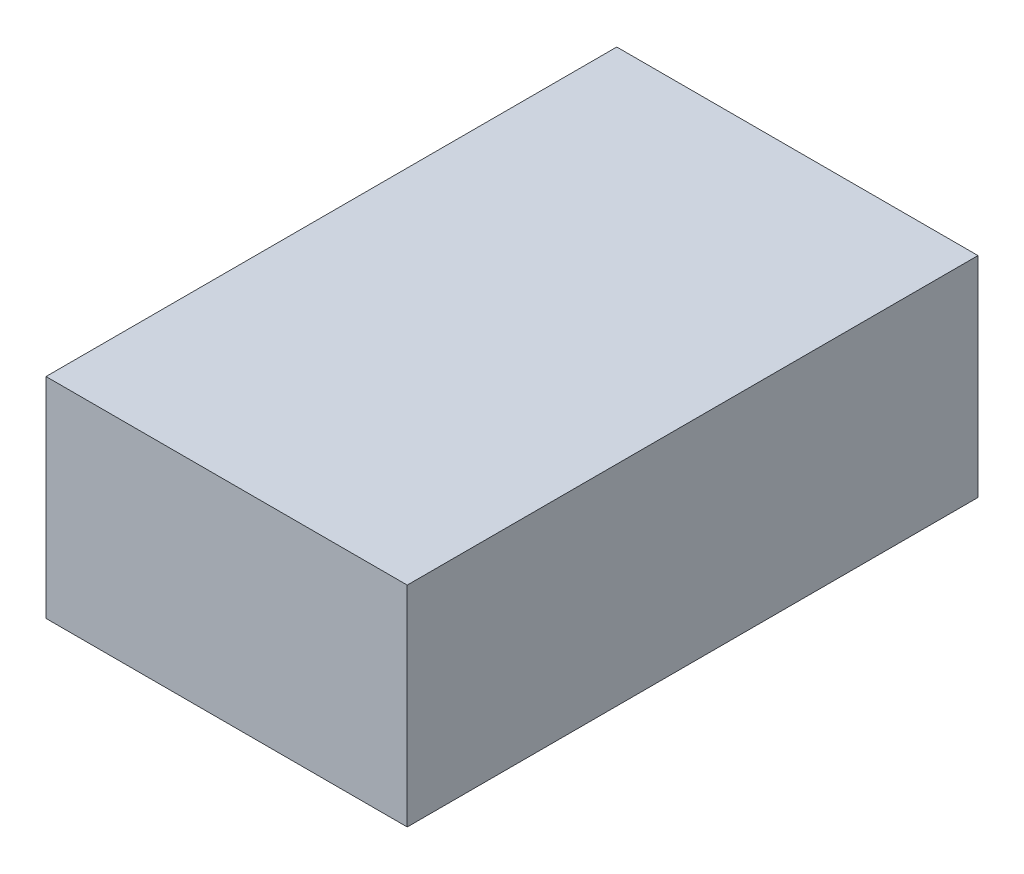
from build123d import *

# Parameters (mm, degrees)
SKETCH4_W           = 250
SKETCH4_H           = 395
BOSS_EXTRUDE4_DEPTH = 145


with BuildPart() as part:
    # Sketch4 → Boss-Extrude4 (new body)
    with BuildSketch(Plane(origin=(0, 0, 0), x_dir=(1, 0, 0), z_dir=(0, 1, 0))):
        with Locations((-0.536393633, 20.670977385)):
            Rectangle(SKETCH4_W, SKETCH4_H)
    extrude(amount=BOSS_EXTRUDE4_DEPTH)


solid = part.part
